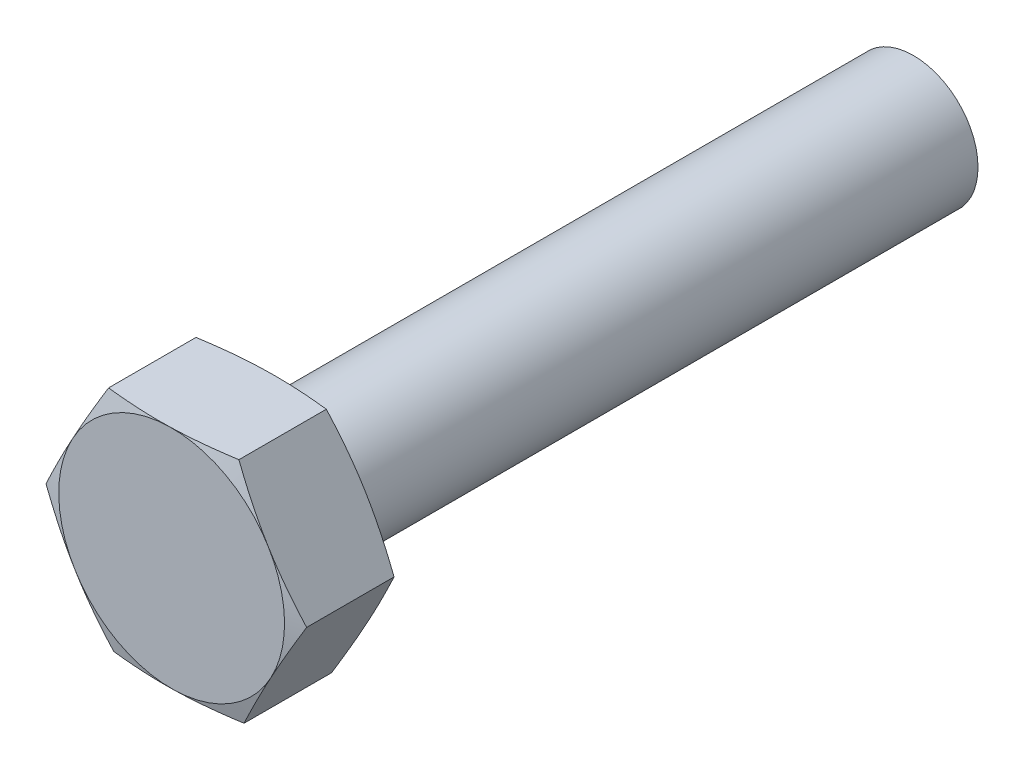
from build123d import *

# Parameters (mm, degrees)
RESSALTO_EXTRUS_O1_DEPTH = 6
ESBO_O2_OUTSIDE_W        = 119.66
ESBO_O2_OUTSIDE_H        = 117.678
ESBO_O2_OUTSIDE_R        = 7
CORTE_EXTRUS_O1_DEPTH    = 13
CORTE_EXTRUS_O1_DRAFT    = -75
ESBO_O9_OUTSIDE_W        = 119.66
ESBO_O9_OUTSIDE_H        = 117.678
ESBO_O9_OUTSIDE_R        = 7
CORTE_EXTRUS_O6_DEPTH    = 13
CORTE_EXTRUS_O6_DRAFT    = -75
ESBO_O10_R               = 4
RESSALTO_EXTRUS_O2_DEPTH = 40


with BuildPart() as part:
    # Esboço1 → Ressalto-extrusão1 (new body)
    with BuildSketch(Plane.XY):
        Polygon((3.880998386, 7.090217547), (-4.199809321, 6.906151968), (-8.080807707, -0.184065579), (-3.880998386, -7.090217547), (4.199809321, -6.906151968), (8.080807707, 0.184065579), align=None)
    extrude(amount=RESSALTO_EXTRUS_O1_DEPTH)


with BuildPart() as corte_extrus_o1_tool:
    # Esboço2 outside → Corte-extrusão1 (with draft: the straight prism first)
    with BuildSketch(Plane.XY.offset(6)):
        Rectangle(ESBO_O2_OUTSIDE_W, ESBO_O2_OUTSIDE_H)
        Circle(ESBO_O2_OUTSIDE_R, mode=Mode.SUBTRACT)
    extrude(amount=-CORTE_EXTRUS_O1_DEPTH)
    # Corte-extrusão1: the draft: its side faces are tilted about the plane it starts from
    corte_extrus_o1_sides = [corte_extrus_o1_tool.faces().sort_by_distance(p)[0] for p in [
        (0, -58.839, -0.5),
        (59.83, 0, -0.5),
        (0, 58.839, -0.5),
        (-59.83, 0, -0.5),
        (-7, 0, -0.5),
    ]]
    draft(corte_extrus_o1_sides, Plane.XY.offset(6), CORTE_EXTRUS_O1_DRAFT)


with BuildPart() as part_1:
    add(part.part)

    # Corte-extrusão1: cut by corte_extrus_o1_tool
    add(corte_extrus_o1_tool.part, mode=Mode.SUBTRACT)


with BuildPart() as corte_extrus_o6_tool:
    # Esboço9 outside → Corte-extrusão6 (with draft: the straight prism first)
    with BuildSketch(Plane(origin=(0, 0, 0), x_dir=(-1, 0, 0), z_dir=(0, 0, -1))):
        Rectangle(ESBO_O9_OUTSIDE_W, ESBO_O9_OUTSIDE_H)
        Circle(ESBO_O9_OUTSIDE_R, mode=Mode.SUBTRACT)
    extrude(amount=-CORTE_EXTRUS_O6_DEPTH)
    # Corte-extrusão6: the draft: its side faces are tilted about the plane it starts from
    corte_extrus_o6_sides = [corte_extrus_o6_tool.faces().sort_by_distance(p)[0] for p in [
        (0, -58.839, 6.5),
        (-59.83, 0, 6.5),
        (0, 58.839, 6.5),
        (59.83, 0, 6.5),
        (7, 0, 6.5),
    ]]
    draft(corte_extrus_o6_sides, Plane(origin=(0, 0, 0), x_dir=(-1, 0, 0), z_dir=(0, 0, -1)), CORTE_EXTRUS_O6_DRAFT)


with BuildPart() as part_2:
    add(part_1.part)

    # Corte-extrusão6: cut by corte_extrus_o6_tool
    add(corte_extrus_o6_tool.part, mode=Mode.SUBTRACT)

    # Esboço10 → Ressalto-extrusão2 (add)
    with BuildSketch(Plane(origin=(0, 0, 0), x_dir=(-1, 0, 0), z_dir=(0, 0, -1))):
        with Locations(Location((0, 0, 0), (0, 0, 180))):
            Circle(ESBO_O10_R)
    extrude(amount=RESSALTO_EXTRUS_O2_DEPTH)


solid = part_2.part
